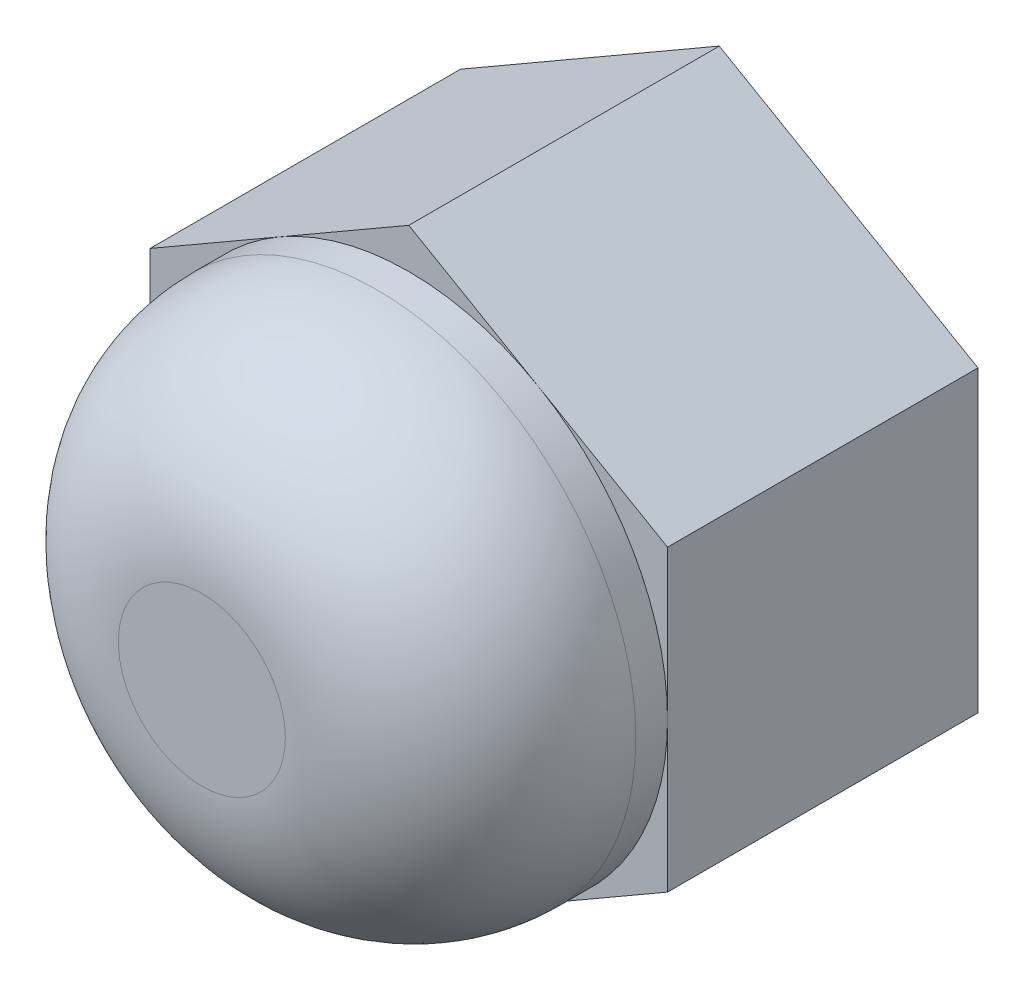
from build123d import *

# Parameters (mm, degrees)
SKETCH1_R           = 7.5
SKETCH1_R_2         = 3.9
BOSS_EXTRUDE1_DEPTH = 9
SKETCH2_R           = 7.5
BOSS_EXTRUDE2_DEPTH = 6
FILLET1_R           = 5.08
FILLET2_R           = 0.254


with BuildPart() as part:
    # Sketch1 → Boss-Extrude1 (new body)
    # profile 1 of 7: a face of its own
    with BuildSketch(Plane(origin=(0, 0, 0), x_dir=(0, 1, 0), z_dir=(0, 0, 1))):
        with BuildLine():
            ThreePointArc((-6.495190512, 3.750000029), (-3.749999976, 6.495190542), (2.2e-08, 7.5))
            Line((2.2e-08, 7.5), (-4.330127019, 7.5))
            Line((-4.330127019, 7.5), (-6.495190512, 3.750000029))
        make_face()
    # profile 2 of 7: a face of its own
    with BuildSketch(Plane(origin=(0, 0, 0), x_dir=(0, 1, 0), z_dir=(0, 0, 1))):
        Circle(SKETCH1_R)
        with Locations(Location((0, 0, 0), (0, 0, 270))):
            Circle(SKETCH1_R_2, mode=Mode.SUBTRACT)
    # profile 3 of 7: a face of its own
    with BuildSketch(Plane(origin=(0, 0, 0), x_dir=(0, 1, 0), z_dir=(0, 0, 1))):
        with BuildLine():
            ThreePointArc((2.2e-08, 7.5), (3.749999991, 6.495190533), (6.495190507, 3.750000037))
            Line((6.495190507, 3.750000037), (4.330127019, 7.5))
            Line((4.330127019, 7.5), (2.2e-08, 7.5))
        make_face()
    # profile 4 of 7: a face of its own
    with BuildSketch(Plane(origin=(0, 0, 0), x_dir=(0, 1, 0), z_dir=(0, 0, 1))):
        with BuildLine():
            ThreePointArc((-6.495190559, -3.749999947), (-7.5, 4.7e-08), (-6.495190512, 3.750000029))
            Line((-6.495190512, 3.750000029), (-8.660254038, 0))
            Line((-8.660254038, 0), (-6.495190559, -3.749999947))
        make_face()
    # profile 5 of 7: a face of its own
    with BuildSketch(Plane(origin=(0, 0, 0), x_dir=(0, 1, 0), z_dir=(0, 0, 1))):
        with BuildLine():
            Line((6.49519047, -3.750000102), (8.660254038, 0))
            Line((8.660254038, 0), (6.495190507, 3.750000037))
            ThreePointArc((6.495190507, 3.750000037), (7.244443692, 1.941142859), (7.5, 0))
            ThreePointArc((7.5, 0), (7.244443682, -1.941142895), (6.49519047, -3.750000102))
        make_face()
    # profile 6 of 7: a face of its own
    with BuildSketch(Plane(origin=(0, 0, 0), x_dir=(0, 1, 0), z_dir=(0, 0, 1))):
        with BuildLine():
            Line((4.330127019, -7.5), (6.49519047, -3.750000102))
            ThreePointArc((6.49519047, -3.750000102), (3.749999939, -6.495190564), (-2.3e-08, -7.5))
            Line((-2.3e-08, -7.5), (4.330127019, -7.5))
        make_face()
    # profile 7 of 7: a face of its own
    with BuildSketch(Plane(origin=(0, 0, 0), x_dir=(0, 1, 0), z_dir=(0, 0, 1))):
        with BuildLine():
            Line((-4.330127019, -7.5), (-2.3e-08, -7.5))
            ThreePointArc((-2.3e-08, -7.5), (-3.750000037, -6.495190507), (-6.495190559, -3.749999947))
            Line((-6.495190559, -3.749999947), (-4.330127019, -7.5))
        make_face()
    extrude(amount=BOSS_EXTRUDE1_DEPTH)

    # Sketch2 → Boss-Extrude2 (add)
    with BuildSketch(Plane.XY.offset(9)):
        Circle(SKETCH2_R)
    extrude(amount=BOSS_EXTRUDE2_DEPTH)

    # Fillet1
    fillet1_edges = [part.edges().sort_by_distance(p)[0] for p in [
        (-7.5, 0, 15),
    ]]
    fillet(fillet1_edges, radius=FILLET1_R)

    # Fillet2
    fillet2_edges = [part.edges().sort_by_distance(p)[0] for p in [
        (-3.9, 0, 0),
    ]]
    fillet(fillet2_edges, radius=FILLET2_R)


solid = part.part
